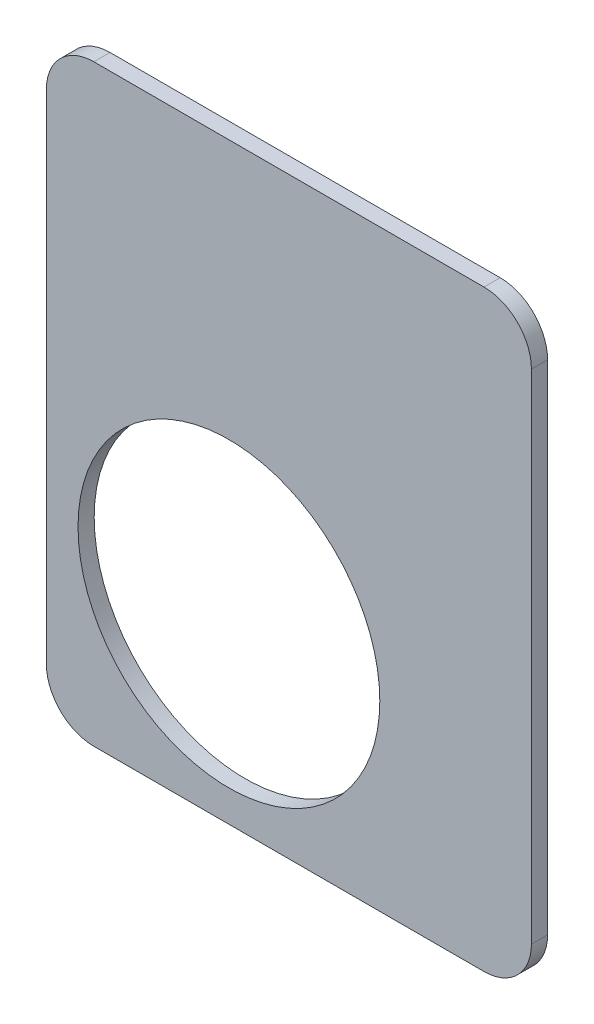
from build123d import *

# Parameters (mm, degrees)
BOSS_EXTRUDE1_DEPTH = 15
SKETCH7_R           = 140
CUT_EXTRUDE3_DEPTH  = 15


with BuildPart() as part:
    # Sketch1 → Boss-Extrude1 (new body)
    with BuildSketch(Plane.XY):
        with BuildLine():
            Line((-112.416665105, 111.821845345), (249.583334895, 111.821845345))
            ThreePointArc((249.583334895, 111.821845345), (280.696033267, 98.934543717), (293.583334895, 67.821845345))
            Line((293.583334895, 67.821845345), (293.583334895, -394.178154655))
            ThreePointArc((293.583334895, -394.178154655), (280.696033267, -425.290853027), (249.583334895, -438.178154655))
            Line((249.583334895, -438.178154655), (-112.416665105, -438.178154655))
            ThreePointArc((-112.416665105, -438.178154655), (-143.529363477, -425.290853027), (-156.416665105, -394.178154655))
            Line((-156.416665105, -394.178154655), (-156.416665105, 67.821845345))
            ThreePointArc((-156.416665105, 67.821845345), (-143.529363477, 98.934543717), (-112.416665105, 111.821845345))
        make_face()
    extrude(amount=BOSS_EXTRUDE1_DEPTH)

    # Sketch7 → Cut-Extrude3 (cut)
    with BuildSketch(Plane.XY.offset(15)):
        with Locations((12.913034287, -269.02154253)):
            Circle(SKETCH7_R)
    extrude(amount=-CUT_EXTRUDE3_DEPTH, mode=Mode.SUBTRACT)


solid = part.part
